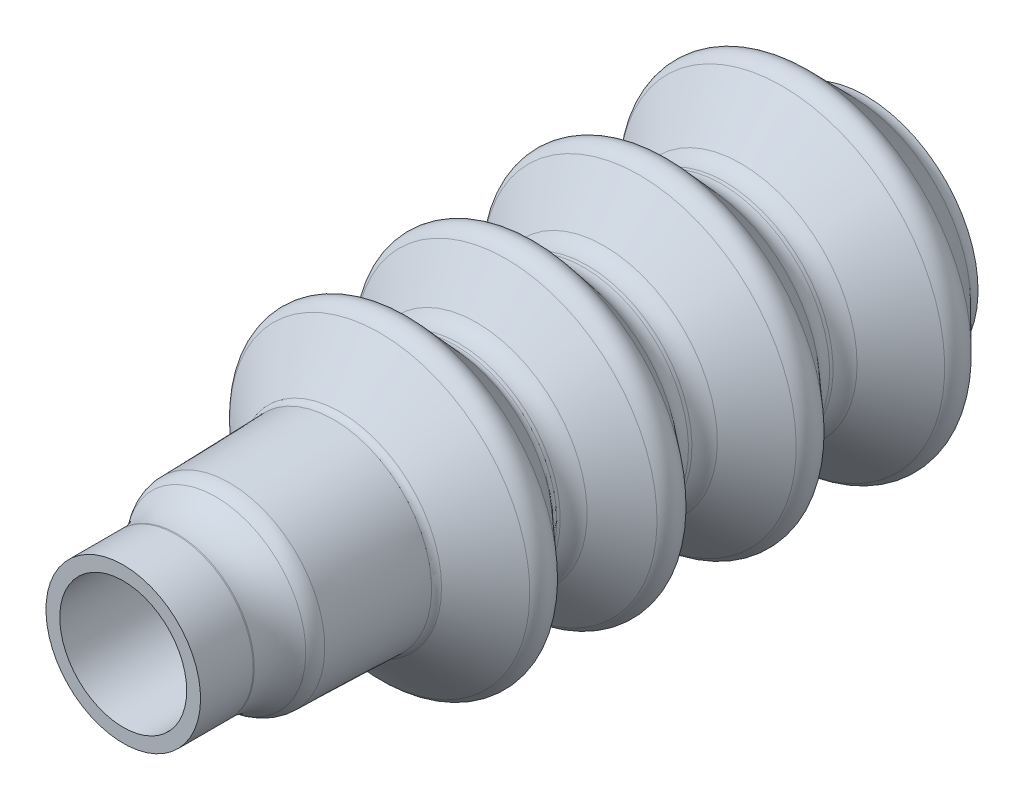
from build123d import *

# Parameters (mm, degrees)
SKETCH21_R         = 7.14375
CUT_EXTRUDE1_DEPTH = 88.781720633


with BuildPart() as part:
    # Sketch20 → Revolve5 (revolve)
    with BuildSketch(Plane(origin=(0, 0, 0), x_dir=(0, 0, -1), z_dir=(1, 0, 0))):
        with BuildLine():
            Line((-274.849490611, 0), (-207.349490611, 0))
            ThreePointArc((-207.349490611, 0), (-208.098635765, 8.142259834), (-201.275255479, 12.647711549))
            ThreePointArc((-201.275255479, 12.647711549), (-202.14014541, 12.8806174), (-202.870414529, 13.399256719))
            Line((-202.870414529, 13.399256719), (-207.765783323, 18.387417939))
            ThreePointArc((-207.765783323, 18.387417939), (-209.246425651, 18.985835526), (-210.693138533, 18.30950192))
            Line((-210.693138533, 18.30950192), (-215.316229055, 13.067992403))
            ThreePointArc((-215.316229055, 13.067992403), (-216.145439142, 12.447176797), (-217.153554415, 12.209048723))
            Line((-217.153554415, 12.209048723), (-217.531345726, 12.198993232))
            ThreePointArc((-217.531345726, 12.198993232), (-218.603121904, 12.4050286), (-219.489494365, 13.041816327))
            Line((-219.489494365, 13.041816327), (-223.709085468, 17.744712666))
            ThreePointArc((-223.709085468, 17.744712666), (-225.25093479, 18.408352899), (-226.755298463, 17.663633066))
            Line((-226.755298463, 17.663633066), (-230.718742879, 12.742932769))
            ThreePointArc((-230.718742879, 12.742932769), (-231.569986193, 12.05989575), (-232.629284744, 11.797138582))
            Line((-232.629284744, 11.797138582), (-233.007076055, 11.787083091))
            ThreePointArc((-233.007076055, 11.787083091), (-234.134097172, 12.017680259), (-235.043806233, 12.72179749))
            Line((-235.043806233, 12.72179749), (-238.600663215, 17.08731598))
            ThreePointArc((-238.600663215, 17.08731598), (-240.204387765, 17.823311571), (-241.766690088, 17.003047351))
            Line((-241.766690088, 17.003047351), (-245.086285669, 12.454501599))
            ThreePointArc((-245.086285669, 12.454501599), (-245.957250925, 11.702989008), (-247.07040962, 11.412766041))
            Line((-247.07040962, 11.412766041), (-247.448200931, 11.40271055))
            ThreePointArc((-247.448200931, 11.40271055), (-247.869141584, 11.483389136), (-248.217643136, 11.732882092))
            Line((-248.217643136, 11.732882092), (-252.944731069, 16.977961992))
            ThreePointArc((-252.944731069, 16.977961992), (-254.483615479, 17.638305076), (-255.98519383, 16.897035443))
            Line((-255.98519383, 16.897035443), (-260.426574873, 11.407922772))
            ThreePointArc((-260.426574873, 11.407922772), (-260.761311123, 11.140244401), (-261.177364049, 11.037287956))
            Line((-261.177364049, 11.037287956), (-272.887414198, 10.72560713))
            ThreePointArc((-272.887414198, 10.72560713), (-273.71301011, 10.564285408), (-274.440639244, 10.14216084))
            ThreePointArc((-274.440639244, 10.14216084), (-276.48003092, 9.010992019), (-278.790858126, 8.696764494))
            ThreePointArc((-278.790858126, 8.696764494), (-278.854919498, 8.699190995), (-278.919021703, 8.7))
            Line((-278.919021703, 8.7), (-284.849490611, 8.7))
            Line((-284.849490611, 8.7), (-284.849490611, 3.236662781))
            Line((-284.849490611, 3.236662781), (-274.849490611, 3.236662781))
            Line((-274.849490611, 3.236662781), (-274.849490611, 0))
        make_face()
    revolve(axis=Axis((0, 0, 139.849490611), (0, 0, 1)))

    # Sketch21 → Cut-Extrude1 (cut, through all)
    with BuildSketch(Plane.XY.offset(284.849490611)):
        Circle(SKETCH21_R)
    extrude(amount=-CUT_EXTRUDE1_DEPTH, mode=Mode.SUBTRACT)


solid = part.part
